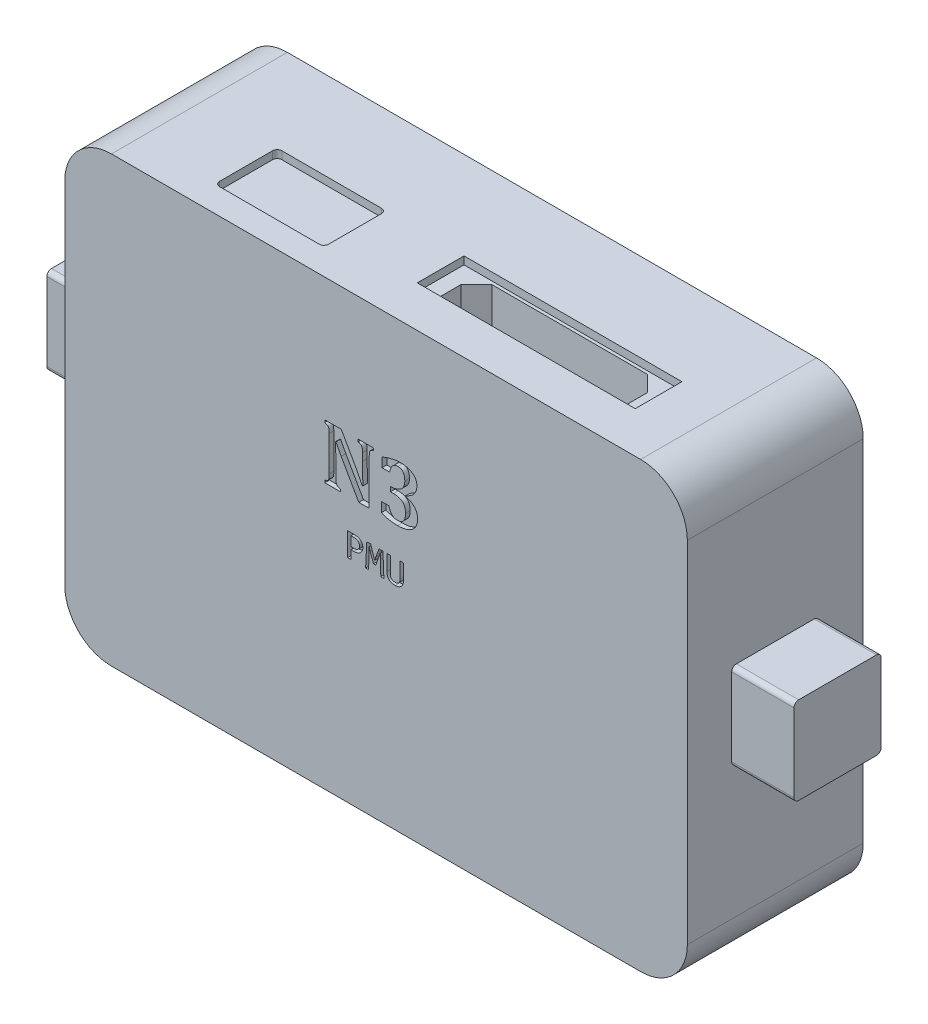
from build123d import *

# Parameters (mm, degrees)
EXTRUDE_1_DEPTH     = 5.65
CUT_EXTRUDE_3_DEPTH = 0.3
EXTRUDE_3_DEPTH     = 4
EXTRUDE_START       = 4
EXTRUDE_4_DEPTH     = 4
CUT_EXTRUDE_5_DEPTH = 4
UP_CAN_3_W          = 14
UP_CAN_3_H          = 3
CUT_EXTRUDE_6_DEPTH = 0.5
CUT_EXTRUDE_7_DEPTH = 0.5


with BuildPart() as part:
    # Main → 凸台-拉伸1 (new, symmetric)
    with BuildSketch(Plane.XY):
        with BuildLine():
            Line((-20, 11.25), (-20, -11.25))
            ThreePointArc((-20, -11.25), (-19.121320344, -13.371320344), (-17, -14.25))
            Line((-17, -14.25), (17, -14.25))
            ThreePointArc((17, -14.25), (19.121320344, -13.371320344), (20, -11.25))
            Line((20, -11.25), (20, 11.25))
            ThreePointArc((20, 11.25), (19.121320344, 13.371320344), (17, 14.25))
            Line((17, 14.25), (-17, 14.25))
            ThreePointArc((-17, 14.25), (-19.121320344, 13.371320344), (-20, 11.25))
        make_face()
    extrude(amount=EXTRUDE_1_DEPTH, both=True)

    # 草图3 → 切除-拉伸3 (cut)
    # profile 1 of 5: a face of its own
    with BuildSketch(Plane.XY.offset(5.65)):
        with BuildLine():
            Line((-0.161653646, 6.307201292), (-0.161653646, 6.161367958))
            add(Edge.make_bspline(
                [(-0.161653646, 6.161367958), (-0.177669577, 6.156235476), (-0.207122243, 6.146797044), (-0.246900488, 6.131171507), (-0.279469724, 6.117829548), (-0.312906932, 6.102024058), (-0.347427448, 6.079192462), (-0.382321405, 6.042359658), (-0.408955266, 5.989839407), (-0.422918392, 5.933915635), (-0.431549055, 5.877250432), (-0.435554473, 5.821903546), (-0.438778121, 5.756314202), (-0.438850306, 5.708935976), (-0.438888889, 5.683611882)],
                knots=[0, 0, 0, 0, 0.975471235, 1.79385316, 2.478592115, 3.017303699, 3.938041953, 4.862988783, 5.927517867, 7.313751775, 8.190433857, 9.251714942, 10.531016607, 12, 12, 12, 12], degree=3))
            Line((-0.438888889, 5.683611882), (-0.438888889, 2.807201292))
            Line((-0.438888889, 2.807201292), (-1.109570312, 2.807201292))
            Line((-1.109570312, 2.807201292), (-2.243576389, 4.802535493))
            add(Edge.make_bspline(
                [(-2.243576389, 4.802535493), (-2.262061977, 4.835447234), (-2.297864844, 4.899190661), (-2.349981257, 4.992106588), (-2.397397164, 5.079949418), (-2.44170538, 5.162098586), (-2.48201379, 5.238793118), (-2.518234642, 5.310060445), (-2.551426649, 5.375634633), (-2.571291416, 5.417976185), (-2.580815972, 5.438277681)],
                knots=[0, 0, 0, 0, 1.258598321, 2.437651948, 3.551981321, 4.586832213, 5.549698172, 6.440681917, 7.252354063, 8, 8, 8, 8], degree=3))
            Line((-2.580815972, 5.438277681), (-2.603602431, 5.438277681))
            add(Edge.make_bspline(
                [(-2.603602431, 5.438277681), (-2.599591716, 5.344101724), (-2.59147488, 5.153509518), (-2.583113042, 4.863596326), (-2.578672736, 4.566077264), (-2.578078581, 4.365036897), (-2.577777778, 4.263255979)],
                knots=[0, 0, 0, 0, 0.96232484, 1.947541814, 2.960899847, 4, 4, 4, 4], degree=3))
            Line((-2.577777778, 4.263255979), (-2.577777778, 3.429271604))
            add(Edge.make_bspline(
                [(-2.577777778, 3.429271604), (-2.577360248, 3.3993976), (-2.576592183, 3.344442964), (-2.574303843, 3.269114776), (-2.568298325, 3.208262066), (-2.558638799, 3.148057851), (-2.535177858, 3.088657172), (-2.499072994, 3.039184043), (-2.457295753, 3.009644248), (-2.414642197, 2.989790918), (-2.361461312, 2.970255391), (-2.321902365, 2.959072708), (-2.300542535, 2.953034625)],
                knots=[0, 0, 0, 0, 1.438978439, 2.647068478, 3.627372042, 4.383140196, 5.576371536, 6.671434312, 7.273846566, 8.020909247, 8.931391092, 10, 10, 10, 10], degree=3))
            Line((-2.300542535, 2.953034625), (-2.300542535, 2.807201292))
            Line((-2.300542535, 2.807201292), (-3.289474826, 2.807201292))
            Line((-3.289474826, 2.807201292), (-3.289474826, 2.953034625))
            add(Edge.make_bspline(
                [(-3.289474826, 2.953034625), (-3.260887566, 2.961497722), (-3.209575028, 2.976688508), (-3.141898216, 3.006316915), (-3.089109373, 3.043258296), (-3.054582463, 3.09524769), (-3.031805913, 3.157665661), (-3.021267721, 3.234246943), (-3.015577407, 3.326622957), (-3.015384102, 3.394316413), (-3.015277778, 3.43155025)],
                knots=[0, 0, 0, 0, 1.149089374, 2.062551405, 2.843955622, 3.594533422, 4.429073491, 5.389328747, 6.564036866, 8, 8, 8, 8], degree=3))
            Line((-3.015277778, 3.43155025), (-3.015277778, 5.682852333))
            add(Edge.make_bspline(
                [(-3.015277778, 5.682852333), (-3.015325243, 5.712984528), (-3.015411829, 5.767951257), (-3.018334, 5.842952579), (-3.023087242, 5.90261003), (-3.032403199, 5.961298476), (-3.054104254, 6.020961153), (-3.091783318, 6.070329356), (-3.134117609, 6.101486773), (-3.176190741, 6.124119037), (-3.229205053, 6.144216392), (-3.268362891, 6.155359926), (-3.289474826, 6.161367958)],
                knots=[0, 0, 0, 0, 1.453211759, 2.650928568, 3.61941141, 4.338124492, 5.512963293, 6.643955544, 7.271627919, 8.036671964, 8.941472357, 10, 10, 10, 10], degree=3))
            Line((-3.289474826, 6.161367958), (-3.289474826, 6.307201292))
            Line((-3.289474826, 6.307201292), (-2.231423611, 6.307201292))
            Line((-2.231423611, 6.307201292), (-1.341232639, 4.730378375))
            add(Edge.make_bspline(
                [(-1.341232639, 4.730378375), (-1.326281235, 4.7032955), (-1.29419107, 4.645167585), (-1.242753958, 4.551273836), (-1.186516622, 4.443784926), (-1.103399271, 4.286116126), (-1.000819197, 4.087585766), (-0.925038386, 3.926245406), (-0.888541667, 3.848542438)],
                knots=[0, 0, 0, 0, 0.561655796, 1.205480602, 1.943652644, 2.764033489, 4.441529425, 6, 6, 6, 6], degree=3))
            Line((-0.888541667, 3.848542438), (-0.84828559, 3.848542438))
            add(Edge.make_bspline(
                [(-0.84828559, 3.848542438), (-0.852568567, 3.954111504), (-0.86132807, 4.170020345), (-0.870286692, 4.500951891), (-0.875728167, 4.846064107), (-0.876165667, 5.080781371), (-0.876388889, 5.200538965)],
                knots=[0, 0, 0, 0, 0.937488971, 1.917343447, 2.937385629, 4, 4, 4, 4], degree=3))
            Line((-0.876388889, 5.200538965), (-0.876388889, 5.682092785))
            add(Edge.make_bspline(
                [(-0.876388889, 5.682092785), (-0.8765491, 5.708169682), (-0.876846263, 5.756537763), (-0.878584804, 5.823462371), (-0.88341317, 5.878643439), (-0.889470731, 5.934140454), (-0.902414163, 5.98793051), (-0.926402611, 6.039529138), (-0.960023933, 6.077406474), (-0.994463834, 6.101933675), (-1.029168865, 6.118696756), (-1.062773812, 6.132948963), (-1.104258254, 6.147203198), (-1.134351907, 6.156404379), (-1.150585937, 6.161367958)],
                knots=[0, 0, 0, 0, 1.50660748, 2.794493175, 3.865833101, 4.705810794, 6.018377177, 7.045366401, 7.95762345, 8.91149549, 9.467497486, 10.181957038, 11.019256184, 12, 12, 12, 12], degree=3))
            Line((-1.150585937, 6.161367958), (-1.150585937, 6.307201292))
            Line((-1.150585937, 6.307201292), (-0.161653646, 6.307201292))
        make_face()
    # profile 2 of 5: a face of its own
    with BuildSketch(Plane.XY.offset(5.65)):
        with BuildLine():
            Line((0.3875, 5.480812403), (0.3875, 6.081615354))
            add(Edge.make_bspline(
                [(0.3875, 6.081615354), (0.440740019, 6.103601001), (0.544910562, 6.14661858), (0.701382153, 6.202099733), (0.853924181, 6.249254445), (1.002588814, 6.288280461), (1.147644136, 6.318087232), (1.288859262, 6.339330677), (1.426551741, 6.352907397), (1.517172623, 6.354854393), (1.561762153, 6.355812403)],
                knots=[0, 0, 0, 0, 1.138871734, 2.228340433, 3.281437788, 4.295392059, 5.266464412, 6.20817041, 7.11833965, 8, 8, 8, 8], degree=3))
            add(Edge.make_bspline(
                [(1.561762153, 6.355812403), (1.612700862, 6.35491021), (1.711831349, 6.353154476), (1.855946997, 6.336134858), (1.991078637, 6.308416711), (2.116218264, 6.268988265), (2.230784195, 6.220083374), (2.332778472, 6.160594215), (2.419627815, 6.088560036), (2.493671249, 6.00797799), (2.55197375, 5.916475895), (2.594306505, 5.815954645), (2.619025084, 5.705807484), (2.62204951, 5.629557521), (2.623611111, 5.590187403)],
                knots=[0, 0, 0, 0, 1.245991689, 2.424791773, 3.545045706, 4.616816666, 5.629595787, 6.587952593, 7.494614438, 8.380594144, 9.255347842, 10.135547138, 11.037327689, 12, 12, 12, 12], degree=3))
            add(Edge.make_bspline(
                [(2.623611111, 5.590187403), (2.622735968, 5.554158468), (2.621031018, 5.483967056), (2.60351275, 5.382098916), (2.57681259, 5.286355946), (2.537203389, 5.197839213), (2.48900985, 5.115118381), (2.431899461, 5.037975403), (2.364854414, 4.966985957), (2.289034787, 4.900407347), (2.202470426, 4.837907658), (2.105401044, 4.776379887), (1.996821144, 4.714672001), (1.91897061, 4.676532146), (1.878493924, 4.65670216)],
                knots=[0, 0, 0, 0, 1.018223358, 1.983698243, 2.915322269, 3.82284993, 4.718315375, 5.619291428, 6.531357531, 7.475260989, 8.469397413, 9.548207294, 10.725243872, 12, 12, 12, 12], degree=3))
            Line((1.878493924, 4.65670216), (1.878493924, 4.633915702))
            add(Edge.make_bspline(
                [(1.878493924, 4.633915702), (1.914332461, 4.626665135), (1.985268492, 4.612313923), (2.088345737, 4.58050901), (2.185825078, 4.538021245), (2.278699343, 4.488413353), (2.364496749, 4.429562042), (2.441580147, 4.36095619), (2.509481243, 4.283301538), (2.567266491, 4.196173322), (2.614853742, 4.101384943), (2.648343733, 3.998239694), (2.668374432, 3.887805197), (2.670917252, 3.811663393), (2.672222222, 3.772587577)],
                knots=[0, 0, 0, 0, 1.026010526, 2.030805963, 3.020916541, 4.0067071, 4.98253303, 5.933933234, 6.895997563, 7.869724968, 8.861364754, 9.863719257, 10.903665134, 12, 12, 12, 12], degree=3))
            add(Edge.make_bspline(
                [(2.672222222, 3.772587577), (2.670475833, 3.724864282), (2.66704771, 3.631184483), (2.639892184, 3.494771243), (2.594916044, 3.366473079), (2.541926714, 3.267301201), (2.491221993, 3.19285027), (2.448082435, 3.140191446), (2.400660821, 3.090064791), (2.347753383, 3.044029038), (2.291156171, 2.999707699), (2.229135573, 2.959567038), (2.162916446, 2.922302126), (2.067455524, 2.87609179), (1.936808858, 2.828026797), (1.766553096, 2.787465527), (1.580692314, 2.763117955), (1.451703991, 2.760136765), (1.384787326, 2.758590181)],
                knots=[0, 0, 0, 0, 1.238691166, 2.431524098, 3.596131476, 4.758044184, 5.339846471, 5.93341988, 6.524072501, 7.129652346, 7.75306838, 8.389559096, 9.046112197, 9.725450149, 11.142277535, 12.650970423, 14.262587788, 16, 16, 16, 16], degree=3))
            add(Edge.make_bspline(
                [(1.384787326, 2.758590181), (1.33716922, 2.759092718), (1.242335341, 2.760093546), (1.100704382, 2.77068084), (0.960201974, 2.786104278), (0.822458508, 2.809197191), (0.689307329, 2.836258219), (0.564478721, 2.871187031), (0.447273325, 2.907813905), (0.374357917, 2.939258022), (0.338888889, 2.954553722)],
                knots=[0, 0, 0, 0, 1.066585531, 2.124159315, 3.180226203, 4.232065357, 5.252166273, 6.22223498, 7.135222593, 8, 8, 8, 8], degree=3))
            Line((0.338888889, 2.954553722), (0.338888889, 3.58497907))
            Line((0.338888889, 3.58497907), (0.825, 3.58497907))
            add(Edge.make_bspline(
                [(0.825, 3.58497907), (0.837189747, 3.541105853), (0.860202393, 3.458278966), (0.907565053, 3.345919547), (0.960730451, 3.251565392), (1.023417455, 3.176118777), (1.096067092, 3.1186378), (1.17921829, 3.079163153), (1.27189704, 3.053713903), (1.337265875, 3.051436264), (1.371115451, 3.050256847)],
                knots=[0, 0, 0, 0, 1.305930177, 2.46542516, 3.491309853, 4.404185451, 5.263440125, 6.128056862, 7.030662191, 8, 8, 8, 8], degree=3))
            add(Edge.make_bspline(
                [(1.371115451, 3.050256847), (1.392164121, 3.050525579), (1.433176166, 3.051049186), (1.492609065, 3.059994493), (1.548059007, 3.072660712), (1.599916425, 3.08987362), (1.646929411, 3.113950828), (1.690785253, 3.141776376), (1.729796272, 3.17587504), (1.765072714, 3.214651632), (1.795252278, 3.259235831), (1.822079278, 3.308261952), (1.84498521, 3.362385836), (1.86284081, 3.422079304), (1.877484799, 3.486747686), (1.886829861, 3.556659277), (1.893110212, 3.631450873), (1.893990014, 3.682946718), (1.894444444, 3.709545042)],
                knots=[0, 0, 0, 0, 1.04932923, 2.044553753, 2.991534269, 3.886518749, 4.762302477, 5.620875306, 6.471885114, 7.33961212, 8.229767994, 9.151377203, 10.125200033, 11.156267991, 12.256683227, 13.430583075, 14.672860224, 16, 16, 16, 16], degree=3))
            add(Edge.make_bspline(
                [(1.894444444, 3.709545042), (1.893923242, 3.738186103), (1.89291031, 3.793848689), (1.883337619, 3.874279752), (1.86974041, 3.949330349), (1.847881869, 4.01803446), (1.821530947, 4.08166875), (1.788878631, 4.139746911), (1.749657985, 4.191956714), (1.704456283, 4.238582024), (1.653392593, 4.280010236), (1.595481177, 4.314755171), (1.532454678, 4.345537522), (1.462480649, 4.369654454), (1.386682245, 4.388295691), (1.304717529, 4.402234305), (1.216545131, 4.409308719), (1.155667314, 4.410667171), (1.124262153, 4.411367958)],
                knots=[0, 0, 0, 0, 1.148071931, 2.231225072, 3.24480356, 4.201827953, 5.116438562, 6.003060875, 6.866114256, 7.727792825, 8.601530905, 9.494871905, 10.430378815, 11.409816751, 12.456422708, 13.558120058, 14.740302521, 16, 16, 16, 16], degree=3))
            Line((1.124262153, 4.411367958), (0.922222222, 4.411367958))
            Line((0.922222222, 4.411367958), (0.922222222, 4.703034625))
            add(Edge.make_bspline(
                [(0.922222222, 4.703034625), (0.958968977, 4.705139352), (1.030367567, 4.709228815), (1.133861524, 4.722240965), (1.23055265, 4.740320703), (1.320626575, 4.763556545), (1.403485769, 4.793092305), (1.479437046, 4.828332616), (1.548758592, 4.868519375), (1.611744672, 4.91395593), (1.666592564, 4.966251749), (1.714960843, 5.023269571), (1.755313557, 5.08630896), (1.789037602, 5.154188993), (1.814991128, 5.227900214), (1.832889709, 5.306920191), (1.84365028, 5.391396436), (1.845090515, 5.449385024), (1.845833333, 5.479293306)],
                knots=[0, 0, 0, 0, 1.294124326, 2.514471056, 3.665273782, 4.75157949, 5.782351101, 6.754339568, 7.691995305, 8.596689159, 9.478484644, 10.35060716, 11.219952716, 12.103948147, 13.010742687, 13.961079669, 14.948403386, 16, 16, 16, 16], degree=3))
            add(Edge.make_bspline(
                [(1.845833333, 5.479293306), (1.845601673, 5.502594758), (1.845150288, 5.547997268), (1.839954798, 5.613741137), (1.83057941, 5.675058041), (1.818822186, 5.732052988), (1.803003196, 5.784774609), (1.782835695, 5.832799392), (1.760733292, 5.877171582), (1.73337706, 5.916086132), (1.704254924, 5.951346789), (1.670709149, 5.981313719), (1.634583481, 6.007411811), (1.594305126, 6.027641831), (1.551844133, 6.044876462), (1.505510174, 6.05596297), (1.456147632, 6.06293274), (1.422030494, 6.063734567), (1.40453559, 6.064145736)],
                knots=[0, 0, 0, 0, 1.342415624, 2.615675512, 3.795773904, 4.914495864, 5.966655767, 6.960891649, 7.913479791, 8.815817395, 9.695585522, 10.542445334, 11.400538855, 12.255277765, 13.132987386, 14.03520706, 14.992475158, 16, 16, 16, 16], degree=3))
            add(Edge.make_bspline(
                [(1.40453559, 6.064145736), (1.384491939, 6.063635193), (1.344910756, 6.062626999), (1.286744903, 6.052384063), (1.230852682, 6.035654563), (1.177220657, 6.011801627), (1.12508323, 5.980681479), (1.077488635, 5.937936797), (1.032105503, 5.886198705), (0.989775583, 5.824689739), (0.951803541, 5.75319374), (0.920110747, 5.671187624), (0.892637928, 5.57984619), (0.880107507, 5.514625874), (0.873611111, 5.480812403)],
                knots=[0, 0, 0, 0, 0.831492998, 1.641990067, 2.443438678, 3.248189408, 4.073881454, 4.952981561, 5.891417605, 6.926545987, 8.045740153, 9.244265423, 10.571289508, 12, 12, 12, 12], degree=3))
            Line((0.873611111, 5.480812403), (0.3875, 5.480812403))
        make_face()
    # profile 3 of 5: a face of its own
    with BuildSketch(Plane.XY.offset(5.65)):
        with BuildLine():
            add(Edge.make_bspline(
                [(-0.847826087, 0.416844572), (-0.84819317, 0.401649218), (-0.848930636, 0.371121882), (-0.855738904, 0.325548058), (-0.866281469, 0.280218449), (-0.880763763, 0.235431129), (-0.899756752, 0.191847749), (-0.9234907, 0.150245177), (-0.952503811, 0.111404926), (-0.985323881, 0.074500096), (-1.023271409, 0.040770279), (-1.066164851, 0.010379421), (-1.11388272, -0.016677028), (-1.166281838, -0.040753728), (-1.224049093, -0.059647666), (-1.287024222, -0.073668349), (-1.355431007, -0.081685229), (-1.402832275, -0.082654768), (-1.427309783, -0.083155428)],
                knots=[0, 0, 0, 0, 0.84837333, 1.704374698, 2.568122001, 3.446177459, 4.329841521, 5.219461111, 6.115085959, 7.03322926, 7.973947317, 8.94447037, 9.964314875, 11.034235969, 12.160282575, 13.352588404, 14.632904974, 16, 16, 16, 16], degree=3))
            Line((-1.427309783, -0.083155428), (-1.608695652, -0.083155428))
            Line((-1.608695652, -0.083155428), (-1.608695652, -0.626633689))
            Line((-1.608695652, -0.626633689), (-1.826086957, -0.626633689))
            Line((-1.826086957, -0.626633689), (-1.826086957, 0.873366311))
            Line((-1.826086957, 0.873366311), (-1.406589674, 0.873366311))
            add(Edge.make_bspline(
                [(-1.406589674, 0.873366311), (-1.388348098, 0.873173118), (-1.352140258, 0.872789648), (-1.298530288, 0.867656163), (-1.24595711, 0.860424508), (-1.194848716, 0.849613458), (-1.145773697, 0.835429928), (-1.099150438, 0.818117241), (-1.056266715, 0.795536157), (-1.015997662, 0.770232699), (-0.978911032, 0.741023), (-0.946284546, 0.70712553), (-0.917509513, 0.669363297), (-0.892587836, 0.627825076), (-0.872068737, 0.581807134), (-0.858278341, 0.53081996), (-0.849020504, 0.475378026), (-0.848233561, 0.436813189), (-0.847826087, 0.416844572)],
                knots=[0, 0, 0, 0, 1.071095419, 2.126025337, 3.160633674, 4.187194637, 5.191188192, 6.159546808, 7.102471747, 8.032359578, 8.950543616, 9.867691343, 10.788184798, 11.733733012, 12.707489344, 13.737062018, 14.82826569, 16, 16, 16, 16], degree=3))
        make_face()
        with BuildLine():
            add(Edge.make_bspline(
                [(-1.065217391, 0.405295659), (-1.065434245, 0.416860055), (-1.065856902, 0.439399495), (-1.070400235, 0.472041011), (-1.077554701, 0.502638253), (-1.087300118, 0.531164705), (-1.099933708, 0.557705281), (-1.115730491, 0.581896924), (-1.134189983, 0.604244549), (-1.15562493, 0.624221094), (-1.179614177, 0.641805477), (-1.205437631, 0.657700678), (-1.233927854, 0.670545369), (-1.264692857, 0.680957945), (-1.29756274, 0.689613835), (-1.332856198, 0.695061141), (-1.370150823, 0.699105706), (-1.395821206, 0.699335557), (-1.408967391, 0.699453268)],
                knots=[0, 0, 0, 0, 1.07893025, 2.102875295, 3.069403633, 4.00867391, 4.911619206, 5.805799344, 6.69897942, 7.61127936, 8.532960211, 9.47193309, 10.436783978, 11.442898866, 12.50165651, 13.605056338, 14.773513735, 16, 16, 16, 16], degree=3))
            Line((-1.408967391, 0.699453268), (-1.608695652, 0.699453268))
            Line((-1.608695652, 0.699453268), (-1.608695652, 0.090757616))
            Line((-1.608695652, 0.090757616), (-1.426290761, 0.090757616))
            add(Edge.make_bspline(
                [(-1.426290761, 0.090757616), (-1.412244658, 0.091062272), (-1.385016773, 0.091652838), (-1.345272556, 0.094962764), (-1.30797301, 0.100916247), (-1.273287228, 0.109871819), (-1.241065891, 0.120684194), (-1.21125147, 0.133891853), (-1.18399768, 0.149977666), (-1.159090552, 0.16831263), (-1.136701838, 0.189072592), (-1.117686016, 0.212815949), (-1.101229752, 0.238715211), (-1.087853457, 0.267239501), (-1.07784145, 0.29833586), (-1.07032595, 0.331741516), (-1.065857166, 0.367697012), (-1.06543532, 0.392488325), (-1.065217391, 0.405295659)],
                knots=[0, 0, 0, 0, 1.232805628, 2.389751021, 3.4973379, 4.54330244, 5.530003372, 6.477393866, 7.399377973, 8.301660217, 9.187431021, 10.070466494, 10.963674817, 11.874940633, 12.827061481, 13.825105319, 14.876436953, 16, 16, 16, 16], degree=3))
        make_face(mode=Mode.SUBTRACT)
    # profile 4 of 5: a face of its own
    with BuildSketch(Plane.XY.offset(5.65)):
        Polygon((0.503736413, -0.626633689), (0.304347826, -0.626633689), (0.281589674, 0.324453268), (0.27173913, 0.66582555), (0.200747283, 0.46270055), (-0.023777174, -0.148372819), (-0.165081522, -0.148372819), (-0.375679348, 0.439602724), (-0.445652174, 0.66582555), (-0.450407609, 0.30814892), (-0.47826087, -0.626633689), (-0.670855978, -0.626633689), (-0.596127717, 0.873366311), (-0.353940217, 0.873366311), (-0.152173913, 0.29252392), (-0.086956522, 0.096532072), (-0.022758152, 0.29252392), (0.192595109, 0.873366311), (0.441236413, 0.873366311), align=None)
    # profile 5 of 5: a face of its own
    with BuildSketch(Plane.XY.offset(5.65)):
        with BuildLine():
            add(Edge.make_bspline(
                [(1.760869565, -0.105234232), (1.760365653, -0.125403124), (1.759377855, -0.164939402), (1.753031381, -0.222830508), (1.741766426, -0.277713792), (1.72626586, -0.329532061), (1.70608661, -0.377939856), (1.682117177, -0.422952161), (1.653565214, -0.464156537), (1.620965696, -0.501635976), (1.584040711, -0.535015576), (1.543381306, -0.564420078), (1.498761676, -0.589599391), (1.45055646, -0.611184127), (1.398287859, -0.627575333), (1.342543642, -0.64001614), (1.282903192, -0.647063245), (1.241865891, -0.647928435), (1.220788043, -0.648372819)],
                knots=[0, 0, 0, 0, 1.11533168, 2.186340517, 3.215329593, 4.209637775, 5.172397981, 6.11082755, 7.024364469, 7.938480506, 8.851566745, 9.770835784, 10.707404611, 11.680049096, 12.68592053, 13.731069016, 14.834616795, 16, 16, 16, 16], degree=3))
            add(Edge.make_bspline(
                [(1.220788043, -0.648372819), (1.197786509, -0.647923833), (1.153600781, -0.647061335), (1.08994305, -0.640310155), (1.031718513, -0.628881716), (0.978599395, -0.613029084), (0.930752212, -0.592489742), (0.887561283, -0.568268154), (0.848868581, -0.540397585), (0.814923398, -0.508478152), (0.785540125, -0.472943103), (0.760738306, -0.433904199), (0.739751961, -0.391716976), (0.723254861, -0.346086886), (0.710827523, -0.297467539), (0.702104836, -0.246110614), (0.696478374, -0.192090034), (0.695931628, -0.155067588), (0.695652174, -0.136144558)],
                knots=[0, 0, 0, 0, 1.312563004, 2.521420972, 3.648051293, 4.694693708, 5.678954229, 6.613532698, 7.515738083, 8.393474785, 9.265531829, 10.140290115, 11.027490559, 11.949473662, 12.903968408, 13.887719697, 14.920364614, 16, 16, 16, 16], degree=3))
            Line((0.695652174, -0.136144558), (0.695652174, 0.873366311))
            Line((0.695652174, 0.873366311), (0.913043478, 0.873366311))
            Line((0.913043478, 0.873366311), (0.913043478, -0.118141841))
            add(Edge.make_bspline(
                [(0.913043478, -0.118141841), (0.913222298, -0.132414306), (0.913567608, -0.15997516), (0.916690704, -0.2000075), (0.921678216, -0.23734779), (0.928746025, -0.272122592), (0.937987085, -0.304405457), (0.950854599, -0.333536763), (0.965267227, -0.360557492), (0.983171269, -0.384421975), (1.003553065, -0.40559714), (1.026804648, -0.423898881), (1.052708015, -0.439495786), (1.081488148, -0.45256766), (1.113486829, -0.462321525), (1.148532491, -0.469293987), (1.186927202, -0.473876786), (1.213640658, -0.474259861), (1.227581522, -0.474459776)],
                knots=[0, 0, 0, 0, 1.246642402, 2.407329763, 3.505429403, 4.535490685, 5.505633834, 6.431662104, 7.312644057, 8.175164385, 9.028562083, 9.873549447, 10.752251869, 11.664173984, 12.627739815, 13.667491001, 14.782741197, 16, 16, 16, 16], degree=3))
            add(Edge.make_bspline(
                [(1.227581522, -0.474459776), (1.240613896, -0.474233021), (1.265966268, -0.473791906), (1.302614155, -0.469420361), (1.336572195, -0.461826538), (1.368014497, -0.45183616), (1.396702702, -0.438476715), (1.422862899, -0.422359821), (1.446501471, -0.403394154), (1.46693785, -0.380903443), (1.484964153, -0.356016187), (1.500636261, -0.328672144), (1.513889746, -0.298957311), (1.524746491, -0.266879263), (1.533169271, -0.232438073), (1.539339725, -0.1956653), (1.542557769, -0.156468939), (1.543165771, -0.12958264), (1.543478261, -0.115764124)],
                knots=[0, 0, 0, 0, 1.143906156, 2.225283924, 3.233450169, 4.19541835, 5.116075032, 6.004390991, 6.887798474, 7.767169552, 8.663955608, 9.581332573, 10.529122189, 11.516238804, 12.550580461, 13.639017649, 14.7865465, 16, 16, 16, 16], degree=3))
            Line((1.543478261, -0.115764124), (1.543478261, 0.873366311))
            Line((1.543478261, 0.873366311), (1.760869565, 0.873366311))
            Line((1.760869565, 0.873366311), (1.760869565, -0.105234232))
        make_face()
    extrude(amount=-CUT_EXTRUDE_3_DEPTH, mode=Mode.SUBTRACT)

    # 草图6 → 凸台-拉伸3 (add)
    with BuildSketch(Plane(origin=(20, 0, 0), x_dir=(0, 0, -1), z_dir=(1, 0, 0))):
        with BuildLine():
            Line((-2.5, 2.8), (2.5, 2.8))
            ThreePointArc((2.5, 2.8), (2.712132034, 2.712132034), (2.8, 2.5))
            Line((2.8, 2.5), (2.8, -2.5))
            ThreePointArc((2.8, -2.5), (2.712132034, -2.712132034), (2.5, -2.8))
            Line((2.5, -2.8), (-2.5, -2.8))
            ThreePointArc((-2.5, -2.8), (-2.712132034, -2.712132034), (-2.8, -2.5))
            Line((-2.8, -2.5), (-2.8, 2.5))
            ThreePointArc((-2.8, 2.5), (-2.712132034, 2.712132034), (-2.5, 2.8))
        make_face()
    extrude(amount=EXTRUDE_3_DEPTH)

    # 草图7 → 凸台-拉伸4 (add)
    with BuildSketch(Plane.ZY.offset(20).offset(EXTRUDE_START)):
        with BuildLine():
            Line((-2.5, 2.8), (2.5, 2.8))
            ThreePointArc((2.5, 2.8), (2.712132034, 2.712132034), (2.8, 2.5))
            Line((2.8, 2.5), (2.8, -2.5))
            ThreePointArc((2.8, -2.5), (2.712132034, -2.712132034), (2.5, -2.8))
            Line((2.5, -2.8), (-2.5, -2.8))
            ThreePointArc((-2.5, -2.8), (-2.712132034, -2.712132034), (-2.8, -2.5))
            Line((-2.8, -2.5), (-2.8, 2.5))
            ThreePointArc((-2.8, 2.5), (-2.712132034, 2.712132034), (-2.5, 2.8))
        make_face()
    extrude(amount=-EXTRUDE_4_DEPTH)

    # UP_CAN → 切除-拉伸5 (cut)
    with BuildSketch(Plane(origin=(0, 14.25, 0), x_dir=(-1, 0, 0), z_dir=(0, 1, 0))):
        Polygon((-1, 1.2), (-1, 2.7), (-13, 2.7), (-13, 1.2), (-12, 0.2), (-2, 0.2), align=None)
    extrude(amount=-CUT_EXTRUDE_5_DEPTH, mode=Mode.SUBTRACT)

    # UP_CAN<3> → 切除-拉伸6 (cut)
    with BuildSketch(Plane(origin=(0, 14.25, 0), x_dir=(-1, 0, 0), z_dir=(0, 1, 0))):
        with Locations((-7, 1.5)):
            Rectangle(UP_CAN_3_W, UP_CAN_3_H)
    extrude(amount=-CUT_EXTRUDE_6_DEPTH, mode=Mode.SUBTRACT)

    # Up_iBat → 切除-拉伸7 (cut)
    with BuildSketch(Plane(origin=(0, 14.25, 0), x_dir=(1, 0, 0), z_dir=(0, 1, 0))):
        with BuildLine():
            Line((-11.7, 0), (-5.3, 0))
            ThreePointArc((-5.3, 0), (-5.087867966, -0.087867966), (-5, -0.3))
            Line((-5, -0.3), (-5, -3.7))
            ThreePointArc((-5, -3.7), (-5.087867966, -3.912132034), (-5.3, -4))
            Line((-5.3, -4), (-11.7, -4))
            ThreePointArc((-11.7, -4), (-11.912132034, -3.912132034), (-12, -3.7))
            Line((-12, -3.7), (-12, -0.3))
            ThreePointArc((-12, -0.3), (-11.912132034, -0.087867966), (-11.7, 0))
        make_face()
    extrude(amount=-CUT_EXTRUDE_7_DEPTH, mode=Mode.SUBTRACT)


solid = part.part
